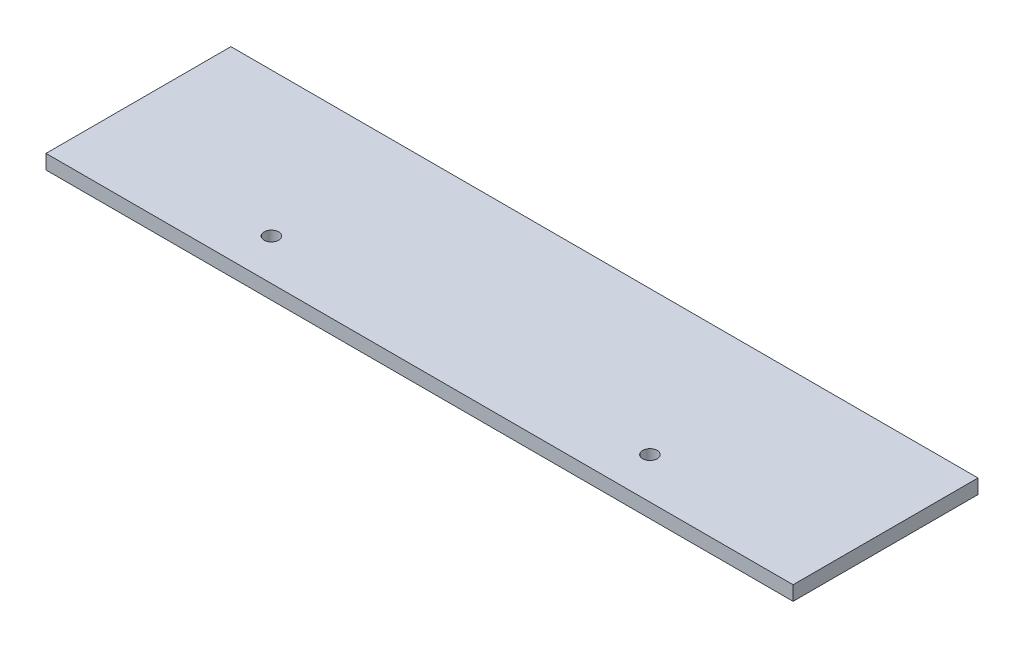
from build123d import *

# Parameters (mm, degrees)
SKETCH1_W           = 153.9436
SKETCH1_H           = 38.1
SKETCH1_R           = 1.5
BOSS_EXTRUDE1_DEPTH = 2.9718


with BuildPart() as part:
    # Sketch1 → Boss-Extrude1 (new body)
    with BuildSketch(Plane(origin=(0, 0, 0), x_dir=(1, 0, 0), z_dir=(0, 1, 0))):
        with Locations((76.9718, 19.05)):
            Rectangle(SKETCH1_W, SKETCH1_H)
        with Locations(Location((37.9718, 8.4718, 0), (0, 0, 270))):
            Circle(SKETCH1_R, mode=Mode.SUBTRACT)
        with Locations(Location((115.9718, 8.4718, 0), (0, 0, 270))):
            Circle(SKETCH1_R, mode=Mode.SUBTRACT)
    extrude(amount=BOSS_EXTRUDE1_DEPTH)


solid = part.part
